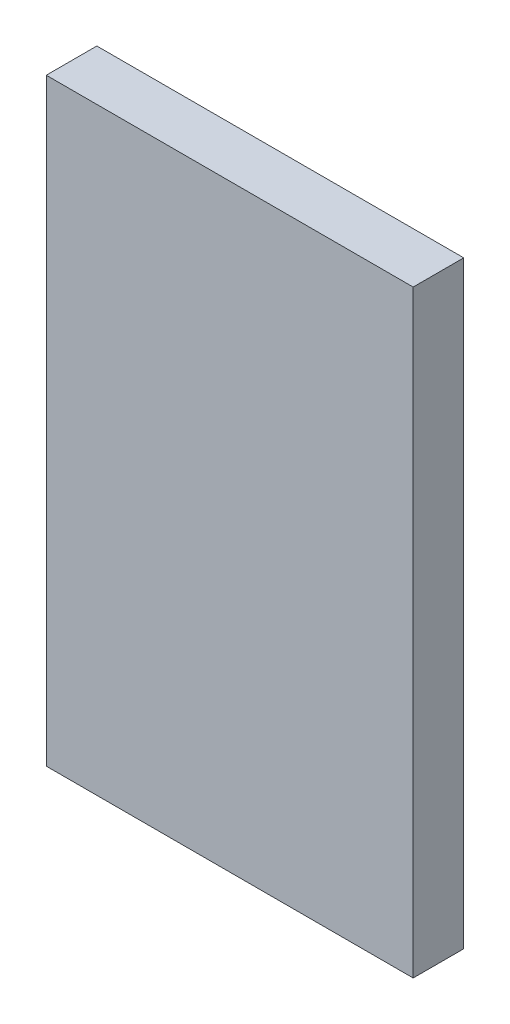
from build123d import *

# Parameters (mm, degrees)
CROQUIS1_W              = 747.222319165
CROQUIS1_H              = 1218.619542483
SALIENTE_EXTRUIR1_DEPTH = 103


with BuildPart() as part:
    # Croquis1 → Saliente-Extruir1 (new body)
    with BuildSketch(Plane.XY):
        with Locations((-235.694900991, -208.80830043)):
            Rectangle(CROQUIS1_W, CROQUIS1_H)
    extrude(amount=SALIENTE_EXTRUIR1_DEPTH)


solid = part.part
